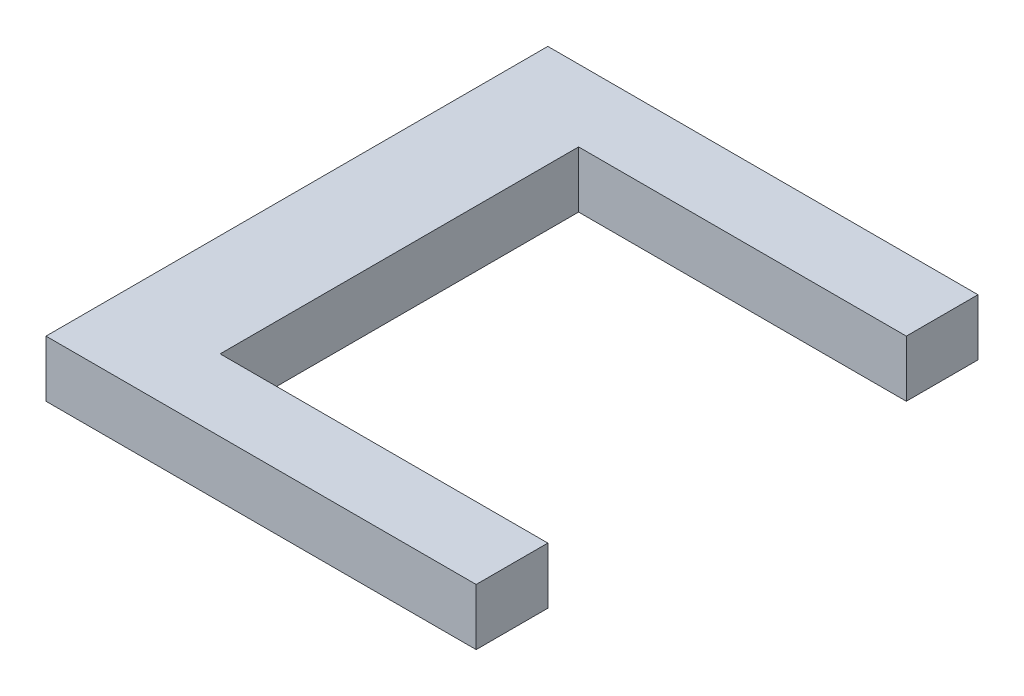
from build123d import *

# Parameters (mm, degrees)
BOSS_EXTRUDE1_DEPTH = 10


with BuildPart() as part:
    # Sketch1 → Boss-Extrude1 (new body)
    with BuildSketch(Plane(origin=(0, 0, 0), x_dir=(1, 0, 0), z_dir=(0, 1, 0))):
        Polygon((18.147487469, 76.2), (76.2, 76.2), (76.2, 88.9), (0, 88.9), (0, 0), (76.2, 0), (76.2, 12.7), (18.147487469, 12.7), align=None)
    extrude(amount=BOSS_EXTRUDE1_DEPTH)


solid = part.part
